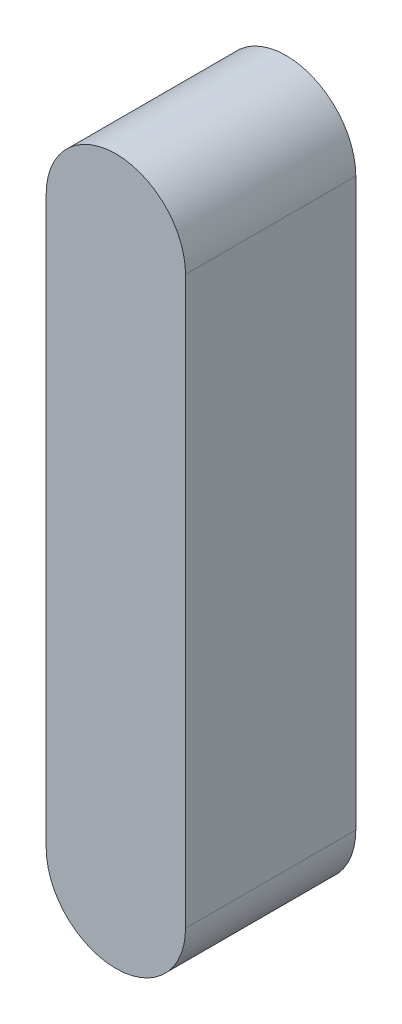
from build123d import *

# Parameters (mm, degrees)
STEM_BLOCK_EXTRUDE_DEPTH      = 55
STEM_BLOCK_EXTRUDE_DEPTH_BACK = 55


with BuildPart() as part:
    # Stem Block Sketch → Stem Block Extrude (new, two sides: drawn at the far end of the back side and taken through both)
    with BuildSketch(Plane.XY.offset(-STEM_BLOCK_EXTRUDE_DEPTH_BACK)):
        with BuildLine():
            Line((-45, 0), (-45, 365.796731079))
            ThreePointArc((-45, 365.796731079), (0, 410.796731079), (45, 365.796731079))
            Line((45, 365.796731079), (45, 0))
            ThreePointArc((45, 0), (0, -45), (-45, 0))
        make_face()
    extrude(amount=STEM_BLOCK_EXTRUDE_DEPTH + STEM_BLOCK_EXTRUDE_DEPTH_BACK)


solid = part.part
